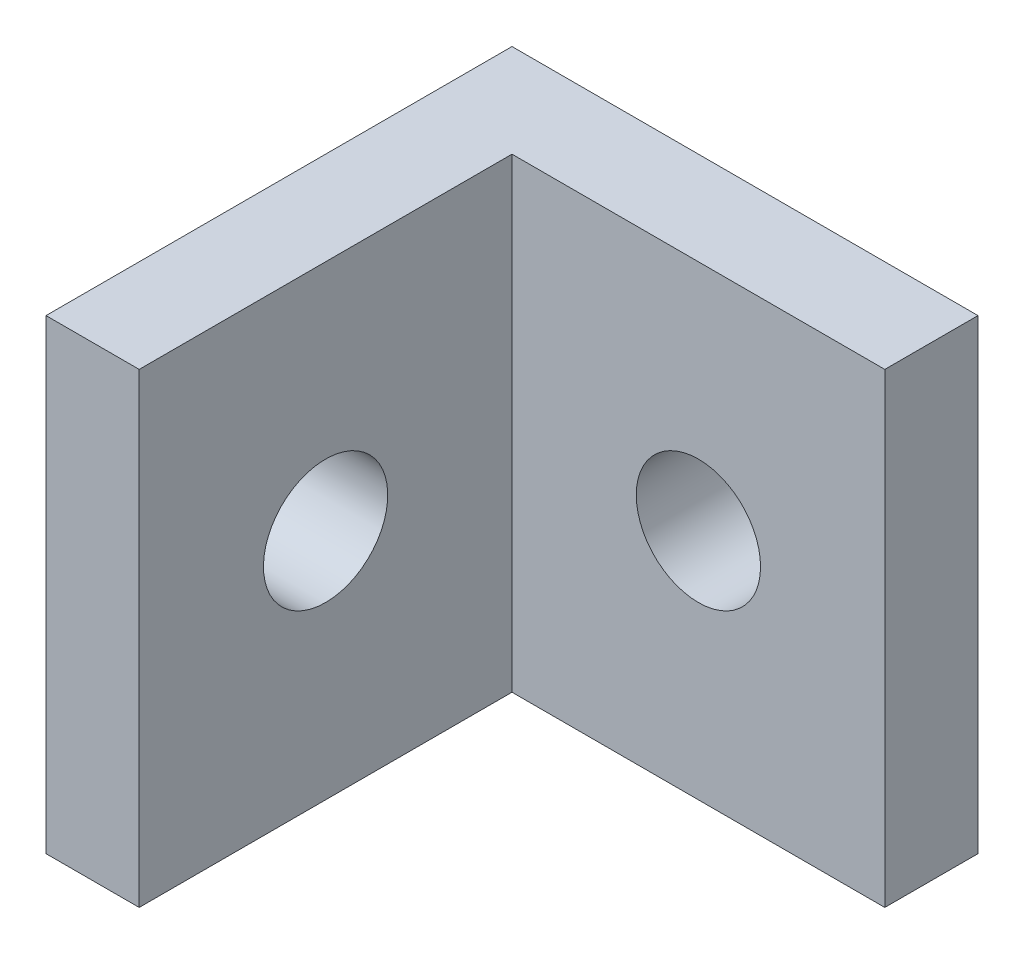
from build123d import *

# Parameters (mm, degrees)
SKETCH1_W           = 15
SKETCH1_H           = 15
BOSS_EXTRUDE1_DEPTH = 3
SKETCH2_W           = 3
SKETCH2_H           = 15
BOSS_EXTRUDE2_DEPTH = 12
SKETCH3_R           = 2
CUT_EXTRUDE1_DEPTH  = 12
SKETCH4_R           = 2
CUT_EXTRUDE2_DEPTH  = 12


with BuildPart() as part:
    # Sketch1 → Boss-Extrude1 (new body)
    with BuildSketch(Plane.XY):
        Rectangle(SKETCH1_W, SKETCH1_H)
    extrude(amount=BOSS_EXTRUDE1_DEPTH)

    # Sketch2 → Boss-Extrude2 (add)
    with BuildSketch(Plane.XY.offset(3)):
        with Locations((-6, 0)):
            Rectangle(SKETCH2_W, SKETCH2_H)
    extrude(amount=BOSS_EXTRUDE2_DEPTH)

    # Sketch3 → Cut-Extrude1 (cut)
    with BuildSketch(Plane(origin=(0, 0, 0), x_dir=(-1, 0, 0), z_dir=(0, 0, -1))):
        with Locations((-1.5, 0)):
            Circle(SKETCH3_R)
    extrude(amount=-CUT_EXTRUDE1_DEPTH, mode=Mode.SUBTRACT)

    # Sketch4 → Cut-Extrude2 (cut)
    with BuildSketch(Plane.ZY.offset(7.5)):
        with Locations(Location((9, 0, 0), (0, 0, 270))):
            Circle(SKETCH4_R)
    extrude(amount=-CUT_EXTRUDE2_DEPTH, mode=Mode.SUBTRACT)


solid = part.part
